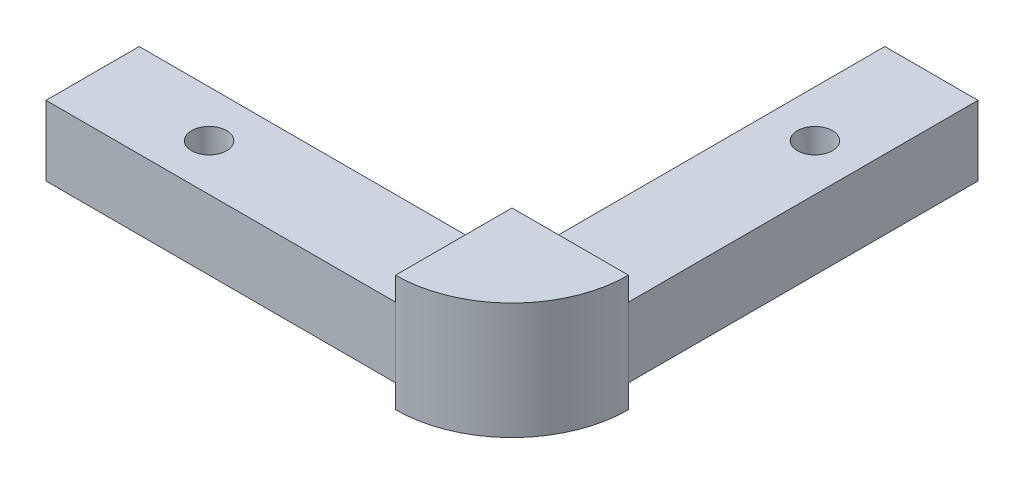
from build123d import *

# Parameters (mm, degrees)
EXTRUDE_5_DEPTH      = 6
EXTRUDE_7_DEPTH      = 2
EXTRUDE_7_DEPTH_BACK = 8
SKETCH_7_R           = 1.5
CUT_EXTRUDE_1_DEPTH  = 10


with BuildPart() as part:
    # 草图5 → 凸台-拉伸5 (new body)
    with BuildSketch(Plane(origin=(0, 0, 0), x_dir=(1, 0, 0), z_dir=(0, 1, 0))):
        with BuildLine():
            Line((-34.334210338, 14.7736082), (-32.334210338, 14.7736082))
            Line((-32.334210338, 14.7736082), (-32.334210338, 44.7736082))
            Line((-32.334210338, 44.7736082), (-24.334210338, 44.7736082))
            Line((-24.334210338, 44.7736082), (-24.334210338, 14.7736082))
            ThreePointArc((-24.334210338, 14.7736082), (-27.263142526, 7.702540389), (-34.334210338, 4.7736082))
            Line((-34.334210338, 4.7736082), (-64.334210338, 4.7736082))
            Line((-64.334210338, 4.7736082), (-64.334210338, 12.7736082))
            Line((-64.334210338, 12.7736082), (-34.334210338, 12.7736082))
            Line((-34.334210338, 12.7736082), (-34.334210338, 14.7736082))
        make_face()
    extrude(amount=EXTRUDE_5_DEPTH)

    # 草图6 → 凸台-拉伸7 (add, two sides: drawn at the far end of the back side and taken through both)
    with BuildSketch(Plane(origin=(0, 6, 0), x_dir=(1, 0, 0), z_dir=(0, 1, 0)).offset(-EXTRUDE_7_DEPTH_BACK)):
        with BuildLine():
            Line((-34.334210338, 14.7736082), (-24.334210338, 14.7736082))
            ThreePointArc((-24.334210338, 14.7736082), (-27.263142526, 7.702540389), (-34.334210338, 4.7736082))
            Line((-34.334210338, 4.7736082), (-34.334210338, 14.7736082))
        make_face()
    extrude(amount=EXTRUDE_7_DEPTH + EXTRUDE_7_DEPTH_BACK)

    # 草图7 → 切除-拉伸1 (cut)
    with BuildSketch(Plane(origin=(0, 6, 0), x_dir=(1, 0, 0), z_dir=(0, 1, 0))):
        with Locations(Location((-54.334210338, 8.7736082, 0), (0, 0, 270))):
            Circle(SKETCH_7_R)
        with Locations(Location((-28.334210338, 34.7736082, 0), (0, 0, 270))):
            Circle(SKETCH_7_R)
    extrude(amount=-CUT_EXTRUDE_1_DEPTH, mode=Mode.SUBTRACT)


solid = part.part
